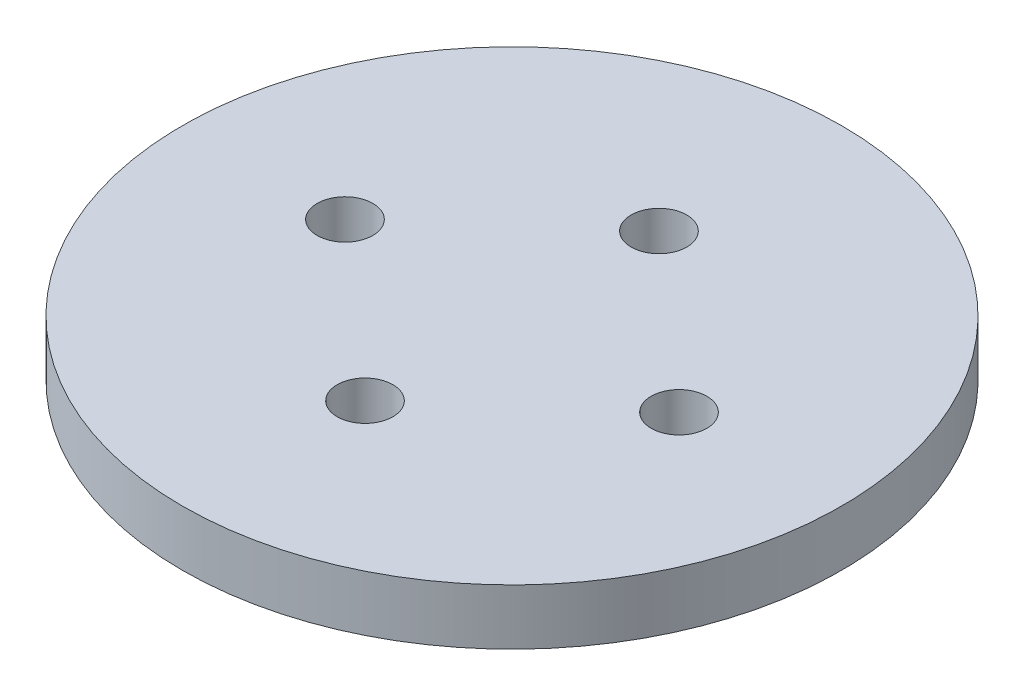
from build123d import *

# Parameters (mm, degrees)
SKETCH1_R           = 37.592
SKETCH1_R_2         = 3.175
BOSS_EXTRUDE1_DEPTH = 6.35


with BuildPart() as part:
    # Sketch1 → Boss-Extrude1 (new body)
    with BuildSketch(Plane(origin=(0, 0, 0), x_dir=(1, 0, 0), z_dir=(0, 1, 0))):
        with Locations(Location((0, 0, 0), (0, 0, 270))):
            Circle(SKETCH1_R)
        with Locations(Location((0, 16.764, 0), (0, 0, 270))):
            Circle(SKETCH1_R_2, mode=Mode.SUBTRACT)
        with Locations(Location((0, -16.764, 0), (0, 0, 270))):
            Circle(SKETCH1_R_2, mode=Mode.SUBTRACT)
        with Locations(Location((-19.05, 0, 0), (0, 0, 270))):
            Circle(SKETCH1_R_2, mode=Mode.SUBTRACT)
        with Locations(Location((19.05, 0, 0), (0, 0, 270))):
            Circle(SKETCH1_R_2, mode=Mode.SUBTRACT)
    extrude(amount=BOSS_EXTRUDE1_DEPTH)


solid = part.part
